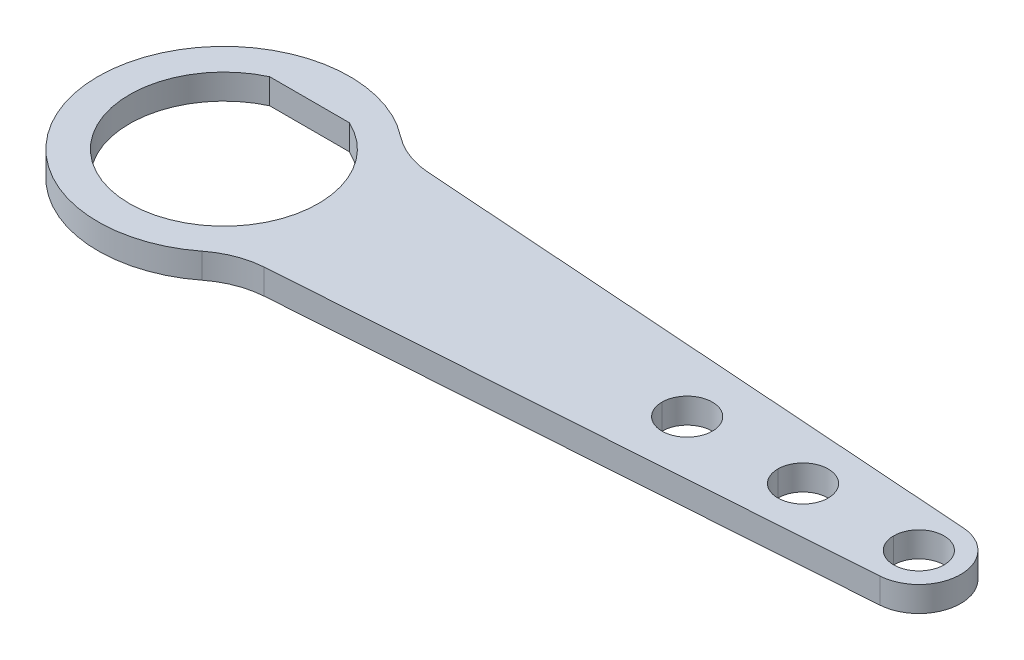
from build123d import *

# Parameters (mm, degrees)
SKETCH1_R               = 2.54
BOSS_EXTRUDE1_DEPTH     = 2.54
CUT_EXTRUDE1_DEPTH      = 76.443052384
CUT_EXTRUDE1_DEPTH_BACK = 76.443052384


with BuildPart() as part:
    # Sketch1 → Boss-Extrude1 (new body)
    with BuildSketch(Plane(origin=(0, 0, 0), x_dir=(1, 0, 0), z_dir=(0, 1, 0))):
        with BuildLine():
            Line((70.398754346, 4.208719598), (12.331459303, 8.275416651))
            ThreePointArc((12.331459303, 8.275416651), (9.945619767, 8.804529388), (7.81864817, 10.007933893))
            ThreePointArc((7.81864817, 10.007933893), (-12.7, 0), (7.81864817, -10.007933893))
            ThreePointArc((7.81864817, -10.007933893), (9.945619767, -8.804529388), (12.331459303, -8.275416651))
            Line((12.331459303, -8.275416651), (70.398754346, -4.208719598))
            ThreePointArc((70.398754346, -4.208719598), (74.323028417, 0), (70.398754346, 4.208719598))
        make_face()
        with Locations(Location((70.104, 0, 0), (0, 0, 270))):
            Circle(SKETCH1_R, mode=Mode.SUBTRACT)
        with Locations(Location((58.42, 0, 0), (0, 0, 270))):
            Circle(SKETCH1_R, mode=Mode.SUBTRACT)
        with Locations(Location((46.736, 0, 0), (0, 0, 270))):
            Circle(SKETCH1_R, mode=Mode.SUBTRACT)
    extrude(amount=BOSS_EXTRUDE1_DEPTH)

    # Sketch3 → Cut-Extrude1 (cut, two sides: drawn at the far end of the back side and taken through both)
    with BuildSketch(Plane(origin=(0, 0, 0), x_dir=(1, 0, 0), z_dir=(0, 1, 0)).offset(-CUT_EXTRUDE1_DEPTH_BACK)):
        with BuildLine():
            Line((-4.018100173, 8.636), (4.018100173, 8.636))
            ThreePointArc((4.018100173, 8.636), (0, -9.525), (-4.018100173, 8.636))
        make_face()
    extrude(amount=CUT_EXTRUDE1_DEPTH + CUT_EXTRUDE1_DEPTH_BACK, mode=Mode.SUBTRACT)


solid = part.part
